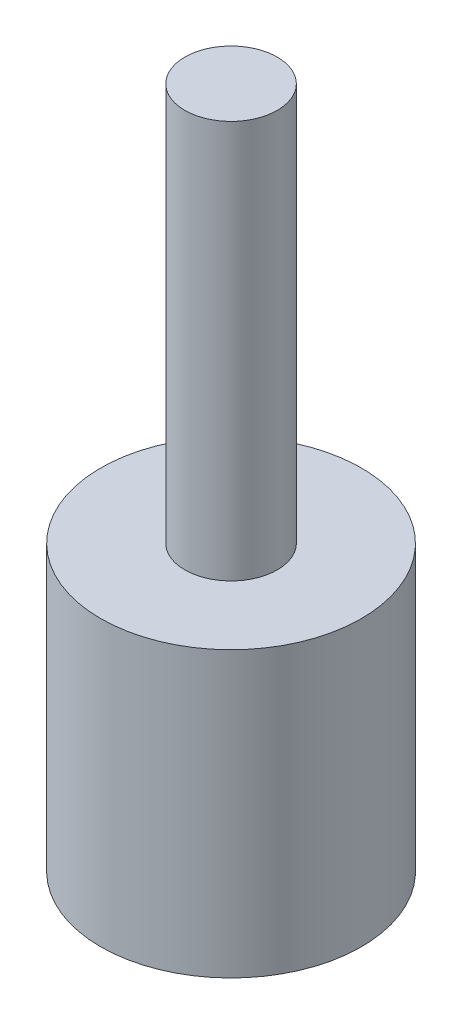
from build123d import *

# Parameters (mm, degrees)
SKETCH2_R           = 9.175
BOSS_EXTRUDE2_DEPTH = 20
SKETCH3_R           = 3.25
BOSS_EXTRUDE3_DEPTH = 28
SKETCH4_R           = 3.175
CUT_EXTRUDE1_DEPTH  = 15


with BuildPart() as part:
    # Sketch2 → Boss-Extrude2 (new body)
    with BuildSketch(Plane(origin=(0, 0, 0), x_dir=(1, 0, 0), z_dir=(0, 1, 0))):
        with Locations(Location((0, 0, 0), (0, 0, 270))):
            Circle(SKETCH2_R)
    extrude(amount=BOSS_EXTRUDE2_DEPTH)

    # Sketch3 → Boss-Extrude3 (add)
    with BuildSketch(Plane(origin=(0, 20, 0), x_dir=(1, 0, 0), z_dir=(0, 1, 0))):
        with Locations(Location((0, 0, 0), (0, 0, 270))):
            Circle(SKETCH3_R)
    extrude(amount=BOSS_EXTRUDE3_DEPTH)

    # Sketch4 → Cut-Extrude1 (cut)
    with BuildSketch(Plane.XZ):
        with Locations(Location((0, 0, 0), (0, 0, 270))):
            Circle(SKETCH4_R)
    extrude(amount=-CUT_EXTRUDE1_DEPTH, mode=Mode.SUBTRACT)


solid = part.part
